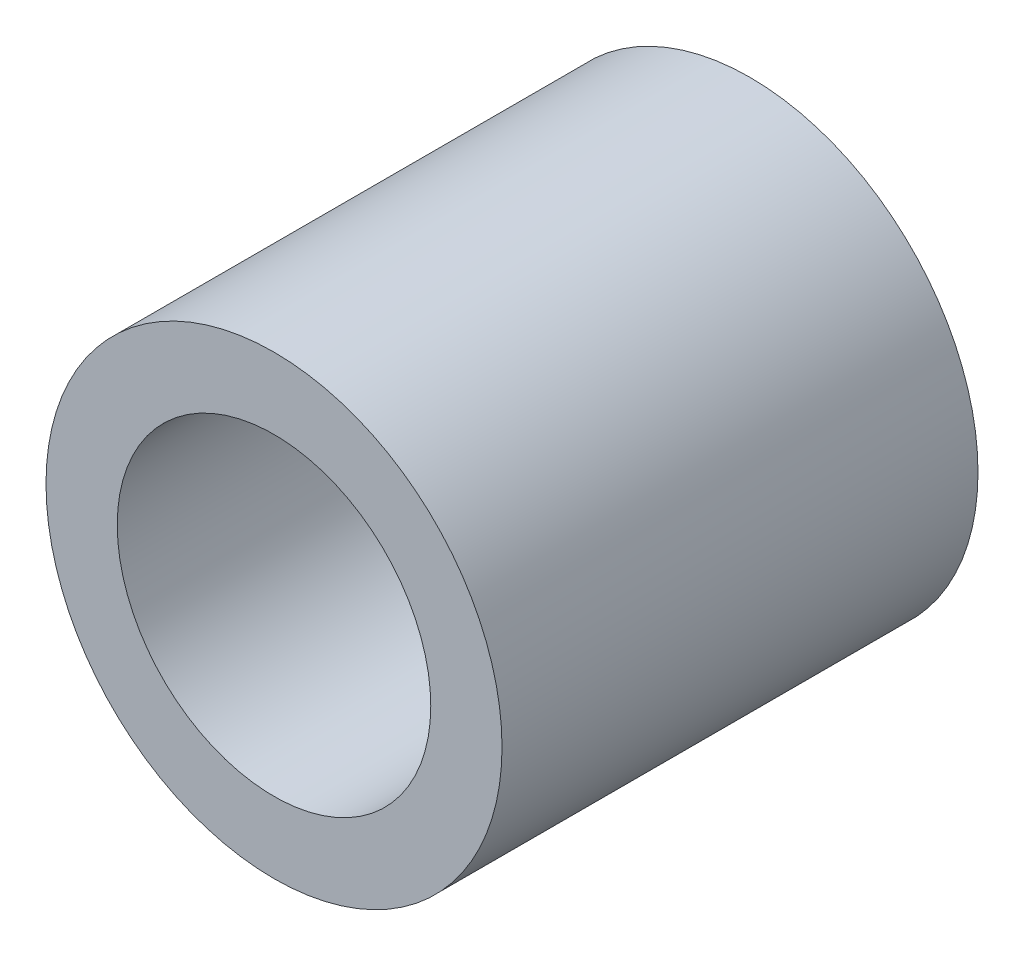
from build123d import *

# Parameters (mm, degrees)
CROQUIS2_R              = 4
CROQUIS2_R_2            = 2.75
SALIENTE_EXTRUIR2_DEPTH = 8.35


with BuildPart() as part:
    # Croquis2 → Saliente-Extruir2 (new body)
    with BuildSketch(Plane.XY):
        Circle(CROQUIS2_R)
        Circle(CROQUIS2_R_2, mode=Mode.SUBTRACT)
    extrude(amount=SALIENTE_EXTRUIR2_DEPTH)


solid = part.part
